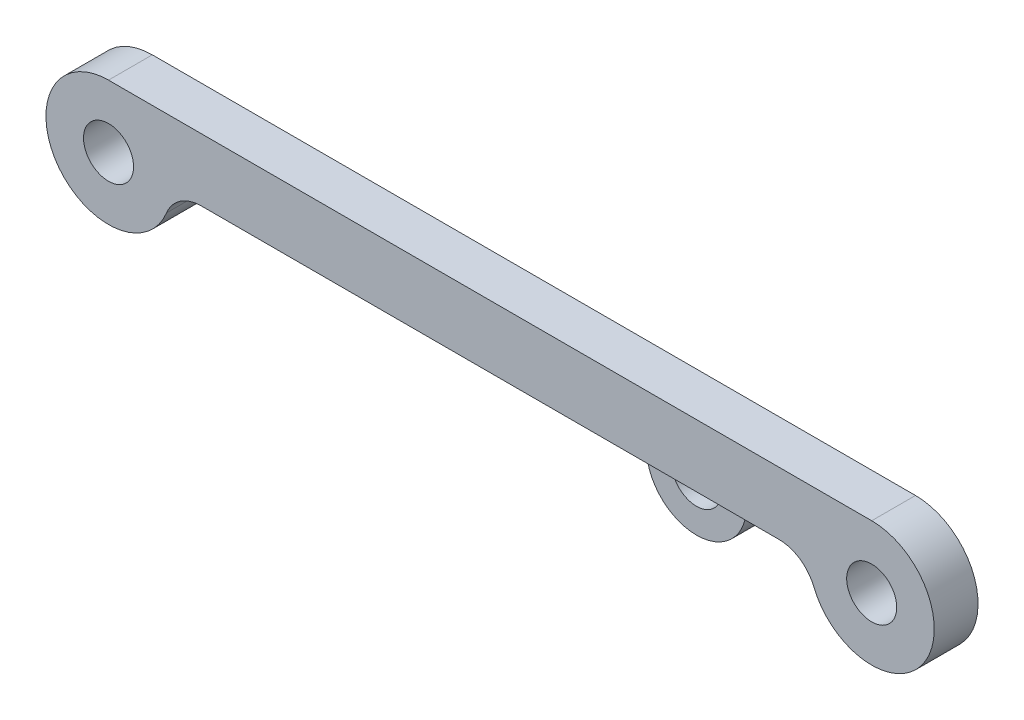
from build123d import *

# Parameters (mm, degrees)
SKETCH1_R           = 2
BOSS_EXTRUDE1_DEPTH = 3.5
BOSS_EXTRUDE3_START = -1
BOSS_EXTRUDE3_DEPTH = 2
FILLET1_R           = 1


with BuildPart() as part:
    # Sketch1 → Boss-Extrude1 (new body)
    with BuildSketch(Plane.XY):
        with BuildLine():
            Line((-63.221147144, 4.5), (-2.221147144, 4.5))
            ThreePointArc((-2.221147144, 4.5), (1.924633844, -3.295084972), (-6.856271198, -2.375))
            ThreePointArc((-6.856271198, -2.375), (-7.960294648, -1.012531407), (-9.637345631, -0.5))
            Line((-9.637345631, -0.5), (-55.804948657, -0.5))
            ThreePointArc((-55.804948657, -0.5), (-57.48199964, -1.012531407), (-58.586023089, -2.375))
            ThreePointArc((-58.586023089, -2.375), (-67.366928132, -3.295084972), (-63.221147144, 4.5))
        make_face()
        with Locations((-63.221147144, -0.5)):
            Circle(SKETCH1_R, mode=Mode.SUBTRACT)
        with Locations((-2.221147144, -0.5)):
            Circle(SKETCH1_R, mode=Mode.SUBTRACT)
    extrude(amount=BOSS_EXTRUDE1_DEPTH)

    # Sketch3 → Boss-Extrude3 (add)
    with BuildSketch(Plane.XY.offset(3.5).offset(BOSS_EXTRUDE3_START)):
        with BuildLine():
            Line((-21.127237453, -1.361660316), (-19.026013205, -1.361660316))
            ThreePointArc((-19.026013205, -1.361660316), (-15.270540556, -0.058260327), (-19.221147144, -0.5))
            Line((-19.221147144, -0.5), (-21.221147144, -0.5))
            ThreePointArc((-21.221147144, -0.5), (-13.244693873, -0.066618664), (-21.127237453, -1.361660316))
        make_face()
    extrude(amount=-BOSS_EXTRUDE3_DEPTH)

    # Fillet1
    fillet1_edges = [part.edges().sort_by_distance(p)[0] for p in [
        (-13.221147144, -0.5, 1.5),
    ]]
    fillet(fillet1_edges, radius=FILLET1_R)


solid = part.part
